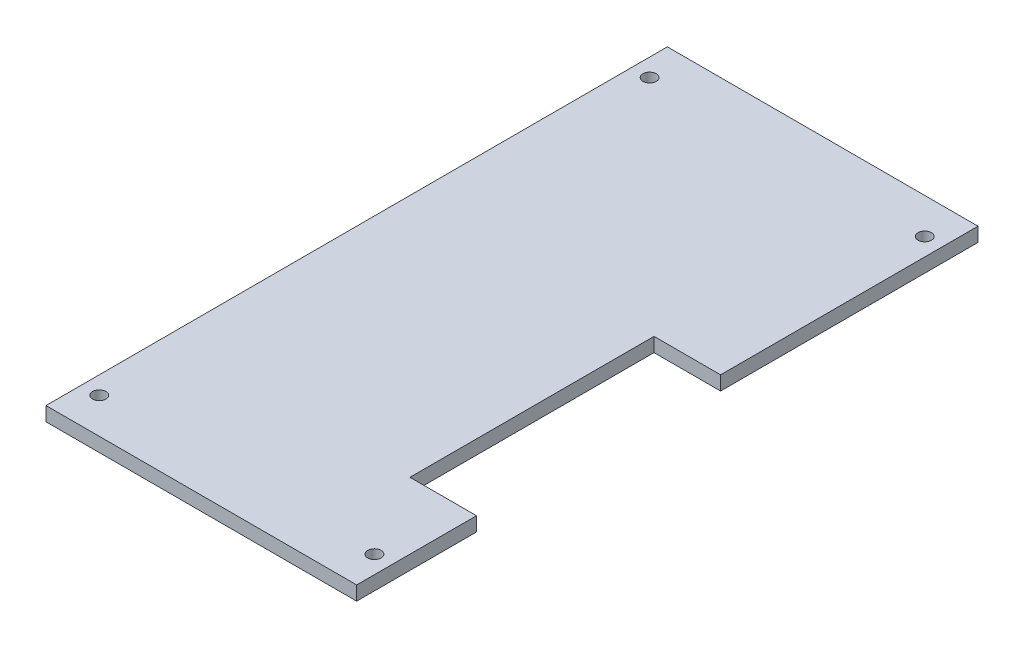
from build123d import *

# Parameters (mm, degrees)
SKETCH1_R           = 1.5
BOSS_EXTRUDE1_DEPTH = 3.175


with BuildPart() as part:
    # Sketch1 → Boss-Extrude1 (new body)
    with BuildSketch(Plane(origin=(0, 0, 0), x_dir=(1, 0, 0), z_dir=(0, 1, 0))):
        Polygon((35, 11.999999982), (20, 11.999999982), (20, -43), (35, -43), (35, -70), (-35, -70), (-35, 70), (35, 70), align=None)
        with Locations(Location((31, -62, 0), (0, 0, 270))):
            Circle(SKETCH1_R, mode=Mode.SUBTRACT)
        with Locations(Location((-31, -62, 0), (0, 0, 90))):
            Circle(SKETCH1_R, mode=Mode.SUBTRACT)
        with Locations(Location((-31, 62, 0), (0, 0, 270))):
            Circle(SKETCH1_R, mode=Mode.SUBTRACT)
        with Locations(Location((31, 62, 0), (0, 0, 90))):
            Circle(SKETCH1_R, mode=Mode.SUBTRACT)
    extrude(amount=BOSS_EXTRUDE1_DEPTH)


solid = part.part
